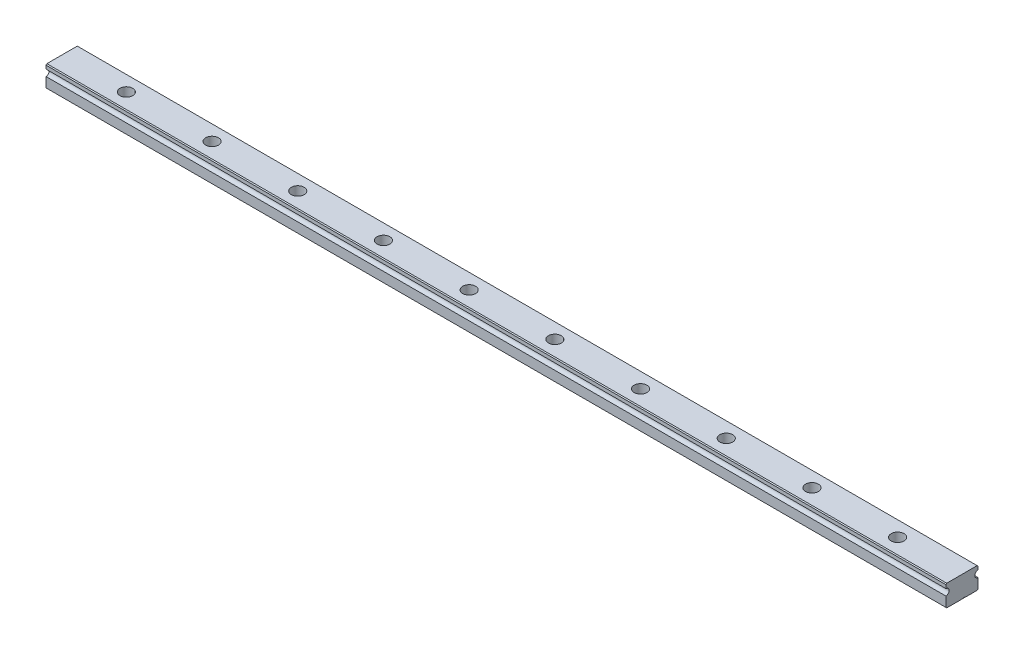
from build123d import *

# Parameters (mm, degrees)
EXTRUDE_1_DEPTH        = 210
SKETCH_2_R             = 3
CUT_EXTRUDE_1_DEPTH    = 4.5
SKETCH_4_R             = 1.75
CUT_EXTRUDE_2_DEPTH    = 211.205851488
PATTERN_LINEAR_1_COUNT = 15
PATTERN_LINEAR_1_PITCH = 40


with BuildPart() as part:
    # 草图1 → 凸台-拉伸1 (new, symmetric)
    with BuildSketch(Plane(origin=(0, 0, 0), x_dir=(0, 0, -1), z_dir=(1, 0, 0))):
        with BuildLine():
            Line((-7.5, 5), (-7.5, 0.4))
            Line((-7.5, 0.4), (-7.1, 0))
            Line((-7.1, 0), (0.7, 0))
            ThreePointArc((0.7, 0), (1, 0.3), (1.3, 0))
            Line((1.3, 0), (7.1, 0))
            Line((7.1, 0), (7.5, 0.4))
            Line((7.5, 0.4), (7.5, 5))
            ThreePointArc((7.5, 5), (6.439339828, 5.439339828), (6, 6.5))
            ThreePointArc((6, 6.5), (6.439339828, 7.560660172), (7.5, 8))
            Line((7.5, 8), (7.5, 9.6))
            Line((7.5, 9.6), (7.1, 10))
            Line((7.1, 10), (-7.1, 10))
            Line((-7.1, 10), (-7.5, 9.6))
            Line((-7.5, 9.6), (-7.5, 8))
            ThreePointArc((-7.5, 8), (-6.439339823, 7.560660166), (-6, 6.499999984))
            ThreePointArc((-6, 6.499999984), (-6.439339834, 5.439339823), (-7.5, 5))
        make_face()
    extrude(amount=EXTRUDE_1_DEPTH, both=True)

    # 草图2 → 切除-拉伸1 (cut)
    with BuildSketch(Plane(origin=(0, 10, 0), x_dir=(1, 0, 0), z_dir=(0, 1, 0))):
        with Locations(Location((-180, 0, 0), (0, 0, 270))):
            Circle(SKETCH_2_R)
    cut_extrude_1 = extrude(amount=-CUT_EXTRUDE_1_DEPTH, mode=Mode.SUBTRACT)

    # 草图4 → 切除-拉伸2 (cut, through all)
    with BuildSketch(Plane(origin=(0, 5.5, 0), x_dir=(1, 0, 0), z_dir=(0, 1, 0))):
        with Locations(Location((-180, 0, 0), (0, 0, 270))):
            Circle(SKETCH_4_R)
    cut_extrude_2 = extrude(amount=-CUT_EXTRUDE_2_DEPTH, mode=Mode.SUBTRACT)

    # 阵列(线性)1: 切除-拉伸1, 切除-拉伸2 ×15
    with Locations(*[(i * PATTERN_LINEAR_1_PITCH, 0, 0) for i in range(1, PATTERN_LINEAR_1_COUNT)]):
        add(cut_extrude_1, mode=Mode.SUBTRACT)
        add(cut_extrude_2, mode=Mode.SUBTRACT)


solid = part.part
